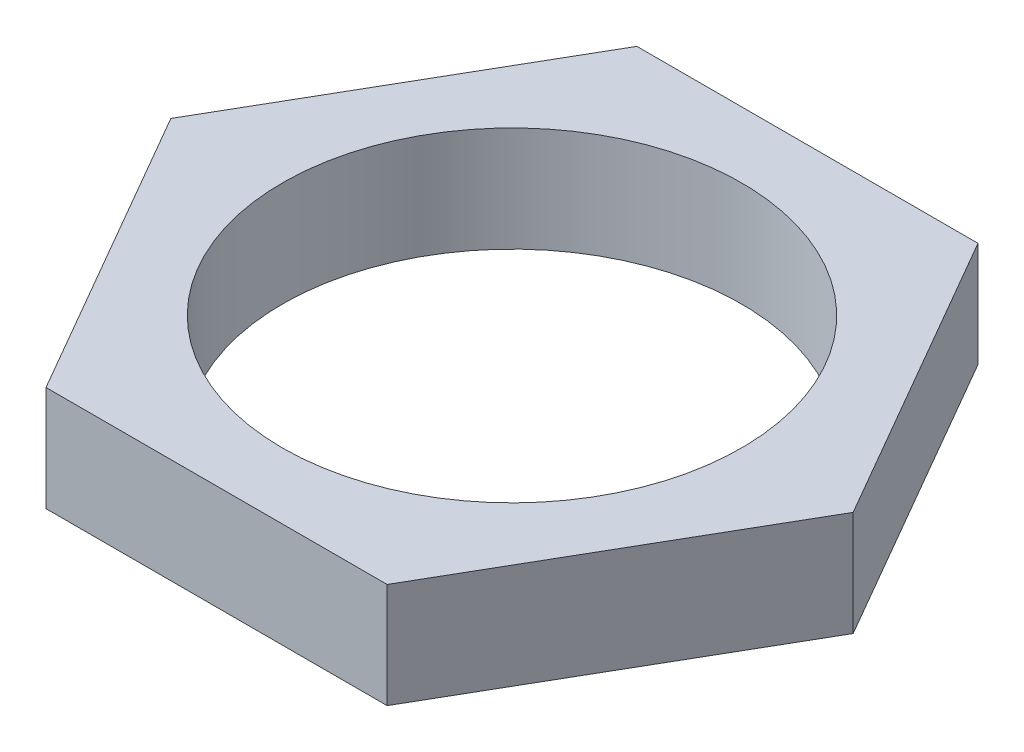
from build123d import *

# Parameters (mm, degrees)
SKETCH1_R           = 5.55625
BOSS_EXTRUDE1_DEPTH = 2.54


with BuildPart() as part:
    # Sketch1 → Boss-Extrude1 (new body)
    with BuildSketch(Plane(origin=(0, 0, 0), x_dir=(1, 0, 0), z_dir=(0, 1, 0))):
        Polygon((4.1275, -7.149039708), (8.255, 0), (4.1275, 7.149039708), (-4.1275, 7.149039708), (-8.255, 0), (-4.1275, -7.149039708), align=None)
        with Locations(Location((0, 0, 0), (0, 0, 270))):
            Circle(SKETCH1_R, mode=Mode.SUBTRACT)
    extrude(amount=BOSS_EXTRUDE1_DEPTH)


solid = part.part
